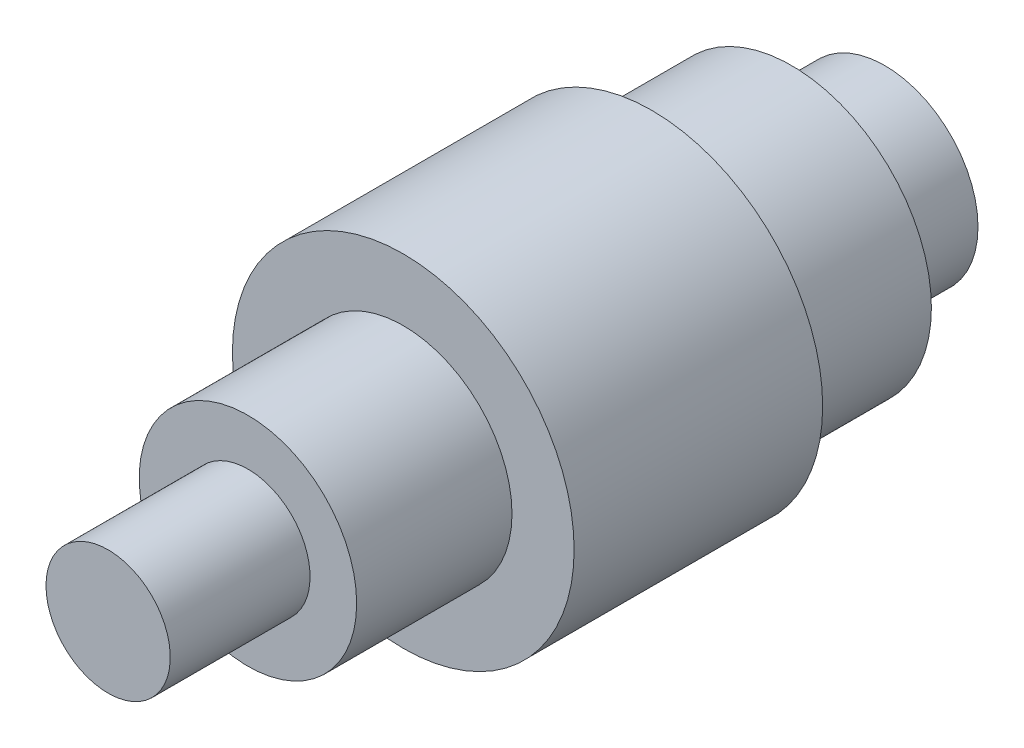
from build123d import *

# Parameters (mm, degrees)
ESBO_O1_R                = 30
RESSALTO_EXTRUS_O1_DEPTH = 30
ESBO_O2_R                = 45
RESSALTO_EXTRUS_O3_DEPTH = 45
ESBO_O3_R                = 55
RESSALTO_EXTRUS_O4_DEPTH = 80
ESBO_O4_R                = 35
RESSALTO_EXTRUS_O5_DEPTH = 50
ESBO_O5_R                = 20
RESSALTO_EXTRUS_O6_DEPTH = 45


with BuildPart() as part:
    # Esboço1 → Ressalto-extrusão1 (new body)
    with BuildSketch(Plane.XY):
        Circle(ESBO_O1_R)
    extrude(amount=RESSALTO_EXTRUS_O1_DEPTH)

    # Esboço2 → Ressalto-extrusão3 (add)
    with BuildSketch(Plane.XY.offset(30)):
        with Locations(Location((0, 0, 0), (0, 0, 180))):
            Circle(ESBO_O2_R)
    extrude(amount=RESSALTO_EXTRUS_O3_DEPTH)

    # Esboço3 → Ressalto-extrusão4 (add)
    with BuildSketch(Plane.XY.offset(75)):
        Circle(ESBO_O3_R)
    extrude(amount=RESSALTO_EXTRUS_O4_DEPTH)

    # Esboço4 → Ressalto-extrusão5 (add)
    with BuildSketch(Plane.XY.offset(155)):
        Circle(ESBO_O4_R)
    extrude(amount=RESSALTO_EXTRUS_O5_DEPTH)

    # Esboço5 → Ressalto-extrusão6 (add)
    with BuildSketch(Plane.XY.offset(205)):
        with Locations(Location((0, 0, 0), (0, 0, 180))):
            Circle(ESBO_O5_R)
    extrude(amount=RESSALTO_EXTRUS_O6_DEPTH)


solid = part.part
